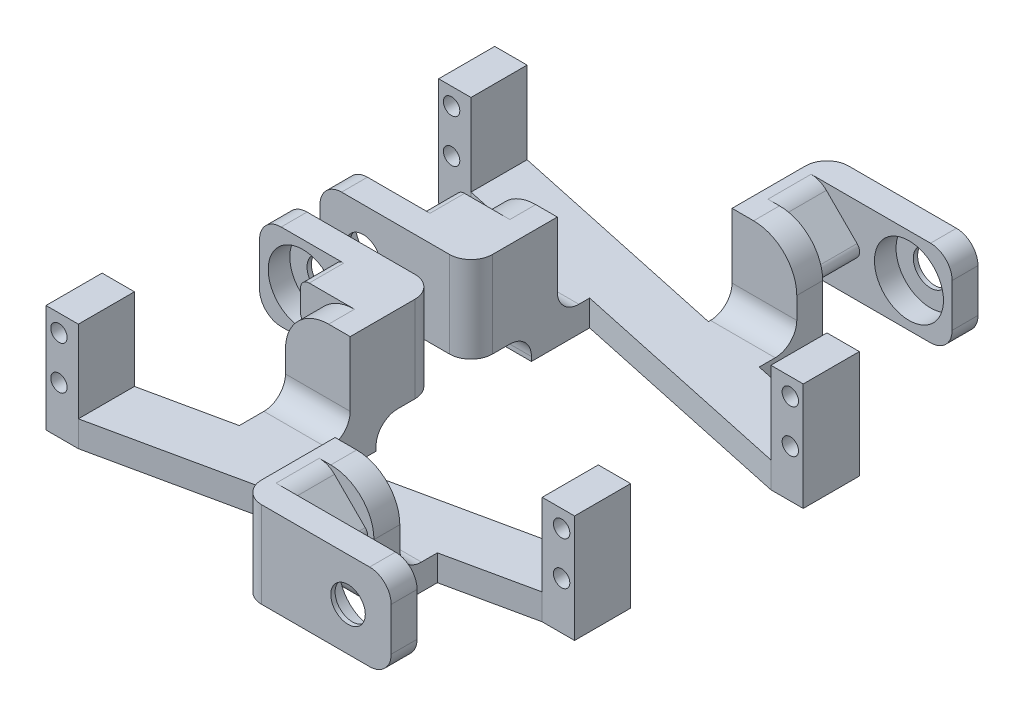
from build123d import *

# Parameters (mm, degrees)
BOSS_EXTRUDE1_DEPTH  = 6
SKETCH3_W            = 7.5
SKETCH3_H            = 13
BOSS_EXTRUDE2_DEPTH  = 19
SKETCH4_R            = 1.9
CUT_EXTRUDE1_DEPTH   = 72.830094668
BOSS_EXTRUDE3_DEPTH  = 6
SKETCH7_W            = 15
SKETCH7_H            = 6
BOSS_EXTRUDE4_DEPTH  = 20
SKETCH9_W            = 20
SKETCH9_H            = 6
BOSS_EXTRUDE5_DEPTH  = 20
SKETCH10_R           = 8
SKETCH10_R_2         = 4
CUT_EXTRUDE2_DEPTH   = 5
SKETCH10_2_R         = 4
CUT_EXTRUDE3_DEPTH   = 15
BOSS_EXTRUDE6_DEPTH  = 16
SKETCH12_W           = 15
SKETCH12_H           = 20
BOSS_EXTRUDE7_DEPTH  = 6
BOSS_EXTRUDE8_DEPTH  = 6
SKETCH14_W           = 15
SKETCH14_H           = 6
BOSS_EXTRUDE9_DEPTH  = 20
BOSS_EXTRUDE10_DEPTH = 8
SKETCH16_W           = 35
SKETCH16_H           = 20
SKETCH16_R           = 8
BOSS_EXTRUDE11_DEPTH = 6
SKETCH18_R           = 8
SKETCH18_R_2         = 4
BOSS_EXTRUDE12_DEPTH = 1
FILLET1_R            = 10
FILLET2_R            = 5


with BuildPart() as part:
    # Sketch2 → Boss-Extrude1 (new body)
    with BuildSketch(Plane(origin=(0, 0, 0), x_dir=(1, 0, 0), z_dir=(0, 1, 0))):
        Polygon((-36.75, 13), (51.75, 32), (59.25, 32), (59.25, 19), (51.75, 19), (-36.75, 0), (-44.25, 0), (-44.25, 13), align=None)
    extrude(amount=BOSS_EXTRUDE1_DEPTH)

    # Sketch3 → Boss-Extrude2 (add)
    with BuildSketch(Plane(origin=(0, 6, 0), x_dir=(1, 0, 0), z_dir=(0, 1, 0))):
        with Locations((-40.5, 6.5)):
            Rectangle(SKETCH3_W, SKETCH3_H)
        with Locations((55.5, 25.5)):
            Rectangle(SKETCH3_W, SKETCH3_H)
    extrude(amount=BOSS_EXTRUDE2_DEPTH)

    # Sketch4 → Cut-Extrude1 (cut, through all)
    with BuildSketch(Plane.XY):
        with Locations((-41.25, 21)):
            Circle(SKETCH4_R)
        with Locations((-41.25, 11)):
            Circle(SKETCH4_R)
        with Locations((56.25, 21)):
            Circle(SKETCH4_R)
        with Locations(Location((56.25, 11, 0), (0, 0, 180))):
            Circle(SKETCH4_R)
    extrude(amount=-CUT_EXTRUDE1_DEPTH, mode=Mode.SUBTRACT)


with BuildPart() as body_2:
    # Mirror1: mirrored copy
    add(part.part.mirror(Plane.XY))

    # Sketch5 → Boss-Extrude3 (add)
    with BuildSketch(Plane(origin=(0, 0, 0), x_dir=(1, 0, 0), z_dir=(0, 1, 0))):
        Polygon((16.75, -11.485875706), (31.75, -14.706214689), (31.75, 0), (16.75, 0), align=None)
    extrude(amount=BOSS_EXTRUDE3_DEPTH)

    # Sketch7 → Boss-Extrude4 (add)
    with BuildSketch(Plane(origin=(0, 6, 0), x_dir=(1, 0, 0), z_dir=(0, 1, 0))):
        with Locations((24.25, -3)):
            Rectangle(SKETCH7_W, SKETCH7_H)
    extrude(amount=BOSS_EXTRUDE4_DEPTH)

    # Sketch11 → Boss-Extrude6 (add)
    with BuildSketch(Plane.XY.offset(-10)):
        with BuildLine():
            Line((22.607864376, 7.464466094), (29.72918472, 14.585786438))
            ThreePointArc((29.72918472, 14.585786438), (30.314971157, 16), (29.72918472, 17.414213562))
            Line((29.72918472, 17.414213562), (22.607864376, 24.535533906))
            ThreePointArc((22.607864376, 24.535533906), (20.985747632, 25.619397663), (19.07233047, 26))
            Line((19.07233047, 26), (16.75, 26))
            Line((16.75, 26), (16.75, 6))
            Line((16.75, 6), (19.07233047, 6))
            ThreePointArc((19.07233047, 6), (20.985747632, 6.380602337), (22.607864376, 7.464466094))
        make_face()
    extrude(amount=BOSS_EXTRUDE6_DEPTH)



with BuildPart() as body_2_2:
    # Sketch9 → Boss-Extrude5 (new body)
    with BuildSketch(Plane(origin=(0, 6, 0), x_dir=(1, 0, 0), z_dir=(0, 1, 0))):
        with Locations((41.75, 13)):
            Rectangle(SKETCH9_W, SKETCH9_H)
    extrude(amount=BOSS_EXTRUDE5_DEPTH)

    # Sketch10 → Cut-Extrude2 (cut)
    with BuildSketch(Plane.XY.offset(-10)):
        with Locations((41.75, 16)):
            Circle(SKETCH10_R)
        with Locations((41.75, 16)):
            Circle(SKETCH10_R_2, mode=Mode.SUBTRACT)
    extrude(amount=-CUT_EXTRUDE2_DEPTH, mode=Mode.SUBTRACT)

    # Sketch10<2> → Cut-Extrude3 (cut)
    with BuildSketch(Plane.XY.offset(-10)):
        with Locations((41.75, 16)):
            Circle(SKETCH10_2_R)
    extrude(amount=-CUT_EXTRUDE3_DEPTH, mode=Mode.SUBTRACT)


with BuildPart() as body_2_1:
    add(body_2.part)

    add(body_2_2.part)  # Boss-Extrude7 merges body 2 2
    # Sketch12 → Boss-Extrude7 (add)
    with BuildSketch(Plane(origin=(0, 0, -10), x_dir=(-1, 0, 0), z_dir=(0, 0, -1))):
        with Locations((-24.25, 16)):
            Rectangle(SKETCH12_W, SKETCH12_H)
    extrude(amount=BOSS_EXTRUDE7_DEPTH)

    # Sketch13 → Boss-Extrude8 (add)
    with BuildSketch(Plane(origin=(0, 0, 0), x_dir=(1, 0, 0), z_dir=(0, 1, 0))):
        Polygon((-1.75, -20.514124294), (-16.75, -17.293785311), (-16.75, -34), (-1.75, -34), align=None)
    extrude(amount=BOSS_EXTRUDE8_DEPTH)

    # Sketch14 → Boss-Extrude9 (add)
    with BuildSketch(Plane(origin=(0, 6, 0), x_dir=(1, 0, 0), z_dir=(0, 1, 0))):
        with Locations((-9.25, -31)):
            Rectangle(SKETCH14_W, SKETCH14_H)
    extrude(amount=BOSS_EXTRUDE9_DEPTH)

    # Sketch15 → Boss-Extrude10 (add)
    with BuildSketch(Plane.XY.offset(34)):
        with BuildLine():
            Line((-19.25, 8), (-19.25, 13.216117819))
            ThreePointArc((-19.25, 13.216117819), (-18.75, 16), (-19.25, 18.783882181))
            Line((-19.25, 18.783882181), (-19.25, 24))
            ThreePointArc((-19.25, 24), (-18.664213562, 25.414213562), (-17.25, 26))
            Line((-17.25, 26), (-1.75, 26))
            Line((-1.75, 26), (-1.75, 6))
            Line((-1.75, 6), (-17.25, 6))
            ThreePointArc((-17.25, 6), (-18.664213562, 6.585786438), (-19.25, 8))
        make_face()
    extrude(amount=BOSS_EXTRUDE10_DEPTH)

    # Sketch16 → Boss-Extrude11 (add)
    with BuildSketch(Plane.XY.offset(42)):
        with Locations((-19.25, 16)):
            Rectangle(SKETCH16_W, SKETCH16_H)
        with Locations(Location((-26.75, 16, 0), (0, 0, 339.635865194))):
            Circle(SKETCH16_R, mode=Mode.SUBTRACT)
    extrude(amount=BOSS_EXTRUDE11_DEPTH)

    # Sketch18 → Boss-Extrude12 (add)
    with BuildSketch(Plane.XY.offset(48)):
        with Locations(Location((-26.75, 16, 0), (0, 0, 339.635865194))):
            Circle(SKETCH18_R)
        with Locations((-26.75, 16)):
            Circle(SKETCH18_R_2, mode=Mode.SUBTRACT)
    extrude(amount=-BOSS_EXTRUDE12_DEPTH)

    # Fillet1
    fillet1_edges = [body_2_1.edges().sort_by_distance(p)[0] for p in [
        (-16.75, 26, 31),
        (31.75, 26, 3),
    ]]
    fillet(fillet1_edges, radius=FILLET1_R)

    # Fillet2
    fillet2_edges = [body_2_1.edges().sort_by_distance(p)[0] for p in [
        (-9.25, 6, 28),
        (-9.25, 6, 34),
        (51.75, 26, -13),
        (-1.75, 16, 48),
        (-36.75, 26, 45),
        (-36.75, 6, 45),
        (16.75, 16, -16),
        (24.25, 0, 0),
        (24.25, 6, 6),
        (51.75, 6, -13),
    ]]
    fillet(fillet2_edges, radius=FILLET2_R)


with BuildPart() as body_2_3:
    # Mirror3: mirrored copy
    add(body_2_1.part.mirror(Plane.XY.offset(52)))


solid = Compound([body_2_1.part, body_2_3.part])
